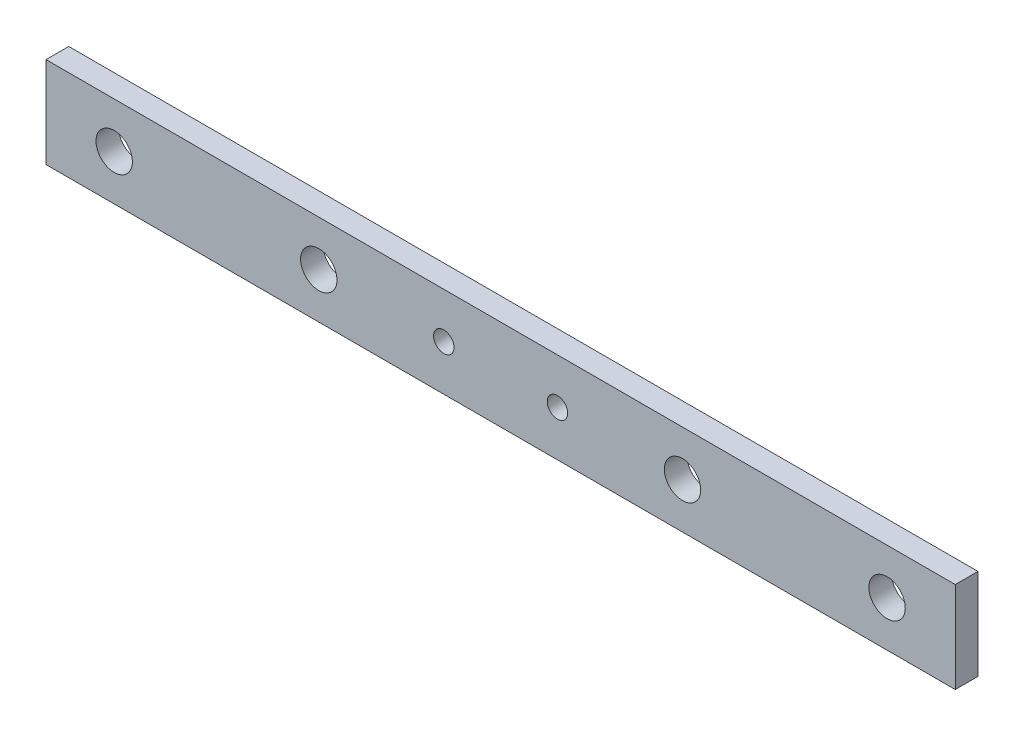
from build123d import *

# Parameters (mm, degrees)
ESQUISSE1_W        = 200
ESQUISSE1_H        = 20
ESQUISSE1_R        = 4
ESQUISSE1_R_2      = 2.25
BOSS_EXTRU_1_DEPTH = 5


with BuildPart() as part:
    # Esquisse1 → Boss.-Extru.1 (new body)
    with BuildSketch(Plane.XY):
        Rectangle(ESQUISSE1_W, ESQUISSE1_H)
        with Locations((85, 0)):
            Circle(ESQUISSE1_R, mode=Mode.SUBTRACT)
        with Locations((-85, 0)):
            Circle(ESQUISSE1_R, mode=Mode.SUBTRACT)
        with Locations((-40, 0)):
            Circle(ESQUISSE1_R, mode=Mode.SUBTRACT)
        with Locations((40, 0)):
            Circle(ESQUISSE1_R, mode=Mode.SUBTRACT)
        with Locations((-12.5, 0)):
            Circle(ESQUISSE1_R_2, mode=Mode.SUBTRACT)
        with Locations((12.5, 0)):
            Circle(ESQUISSE1_R_2, mode=Mode.SUBTRACT)
    extrude(amount=BOSS_EXTRU_1_DEPTH)


solid = part.part
